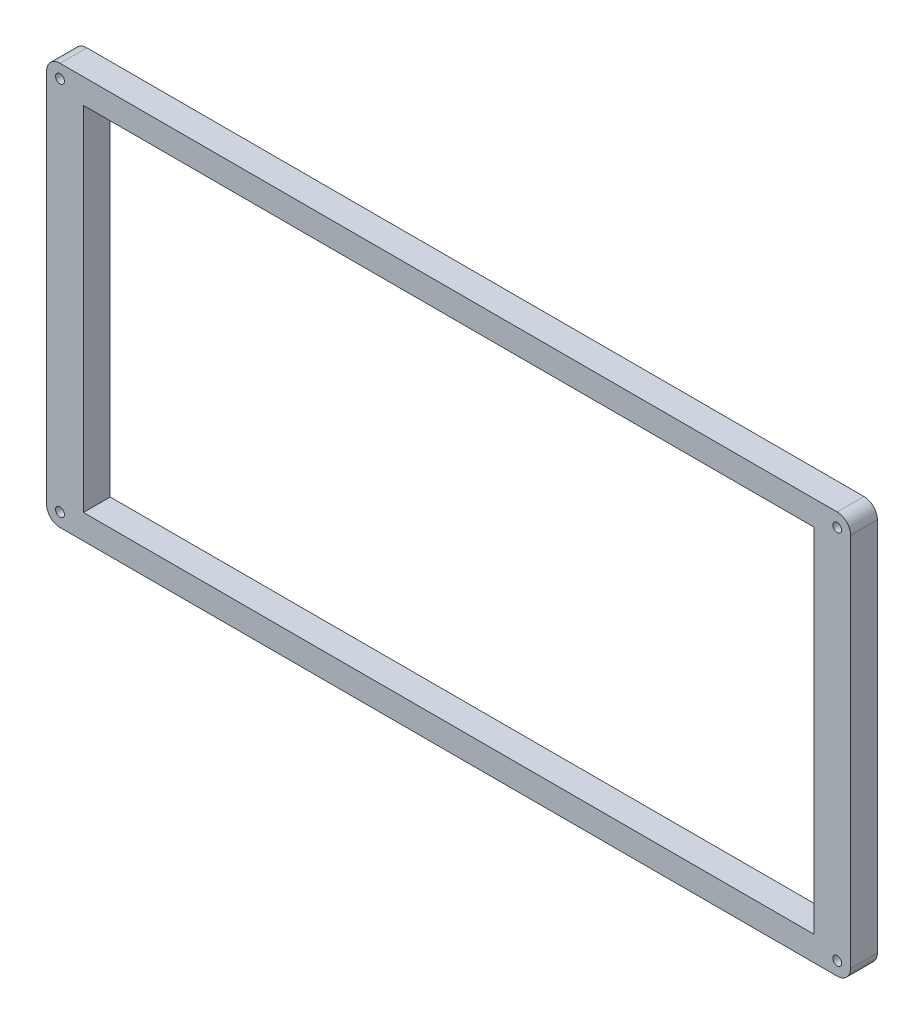
from build123d import *

# Parameters (mm, degrees)
SKETCH_1_R      = 1.65
SKETCH_1_W      = 272.523786307
SKETCH_1_H      = 131.563207183
EXTRUDE_4_DEPTH = 10


with BuildPart() as part:
    # 草图1 → 凸台-拉伸4 (new body)
    with BuildSketch(Plane.XY):
        with BuildLine():
            Line((-77.155190134, 109.874140248), (212.844809866, 109.874140248))
            ThreePointArc((212.844809866, 109.874140248), (216.380343772, 108.409674154), (217.844809866, 104.874140248))
            Line((217.844809866, 104.874140248), (217.844809866, -35.125859752))
            ThreePointArc((217.844809866, -35.125859752), (216.380343772, -38.661393658), (212.844809866, -40.125859752))
            Line((212.844809866, -40.125859752), (-77.155190134, -40.125859752))
            ThreePointArc((-77.155190134, -40.125859752), (-80.69072404, -38.661393658), (-82.155190134, -35.125859752))
            Line((-82.155190134, -35.125859752), (-82.155190134, 104.874140248))
            ThreePointArc((-82.155190134, 104.874140248), (-80.69072404, 108.409674154), (-77.155190134, 109.874140248))
        make_face()
        with Locations((-77.155190134, 104.874140248)):
            Circle(SKETCH_1_R, mode=Mode.SUBTRACT)
        with Locations((212.844809866, -35.125859752)):
            Circle(SKETCH_1_R, mode=Mode.SUBTRACT)
        with Locations((-77.155190134, -35.125859752)):
            Circle(SKETCH_1_R, mode=Mode.SUBTRACT)
        with Locations((212.844809866, 104.874140248)):
            Circle(SKETCH_1_R, mode=Mode.SUBTRACT)
        with Locations((67.844809867, 34.874140248)):
            Rectangle(SKETCH_1_W, SKETCH_1_H, mode=Mode.SUBTRACT)
    extrude(amount=EXTRUDE_4_DEPTH)


solid = part.part
